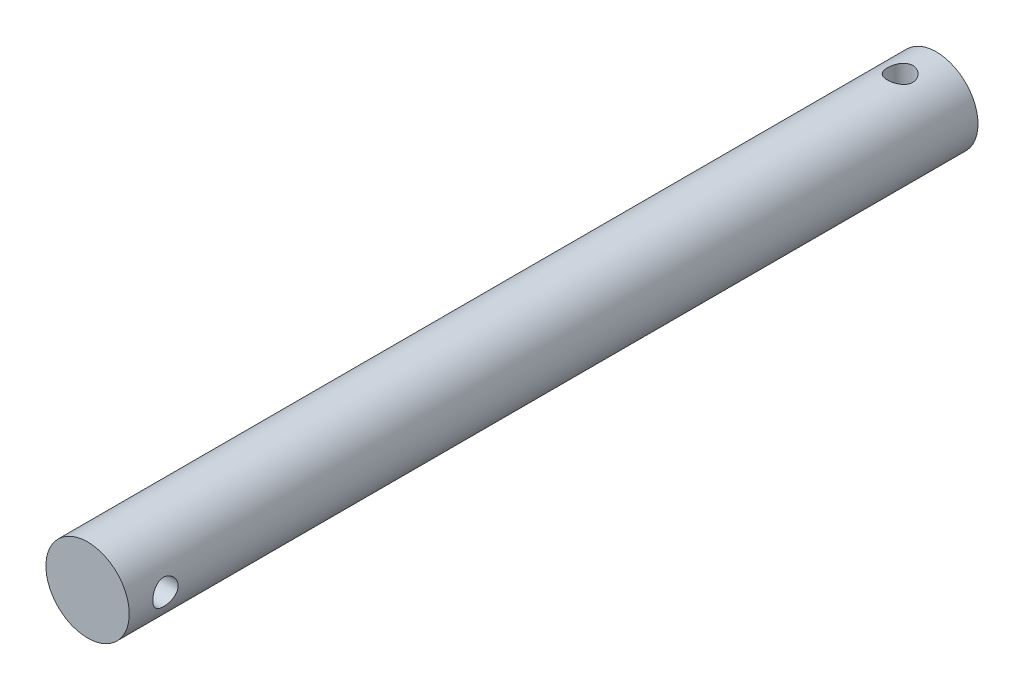
from build123d import *

# Parameters (mm, degrees)
SKETCH3_R           = 5.75
BOSS_EXTRUDE1_DEPTH = 117.15
SKETCH4_R           = 1.75
CUT_EXTRUDE2_DEPTH  = 15
SKETCH5_R           = 1.75
CUT_EXTRUDE3_DEPTH  = 15


with BuildPart() as part:
    # Sketch3 → Boss-Extrude1 (new body)
    with BuildSketch(Plane.XY):
        Circle(SKETCH3_R)
    extrude(amount=BOSS_EXTRUDE1_DEPTH)

    # Sketch4 → Cut-Extrude2 (cut, symmetric)
    with BuildSketch(Plane(origin=(0, 0, 0), x_dir=(1, 0, 0), z_dir=(0, 1, 0))):
        with Locations(Location((0, -5, 0), (0, 0, 90))):
            Circle(SKETCH4_R)
    extrude(amount=CUT_EXTRUDE2_DEPTH, both=True, mode=Mode.SUBTRACT)

    # Sketch5 → Cut-Extrude3 (cut, symmetric)
    with BuildSketch(Plane(origin=(0, 0, 0), x_dir=(0, 0, -1), z_dir=(1, 0, 0))):
        with Locations(Location((-112.15, 0, 0), (0, 0, 179.999999999))):
            Circle(SKETCH5_R)
    extrude(amount=CUT_EXTRUDE3_DEPTH, both=True, mode=Mode.SUBTRACT)


solid = part.part
